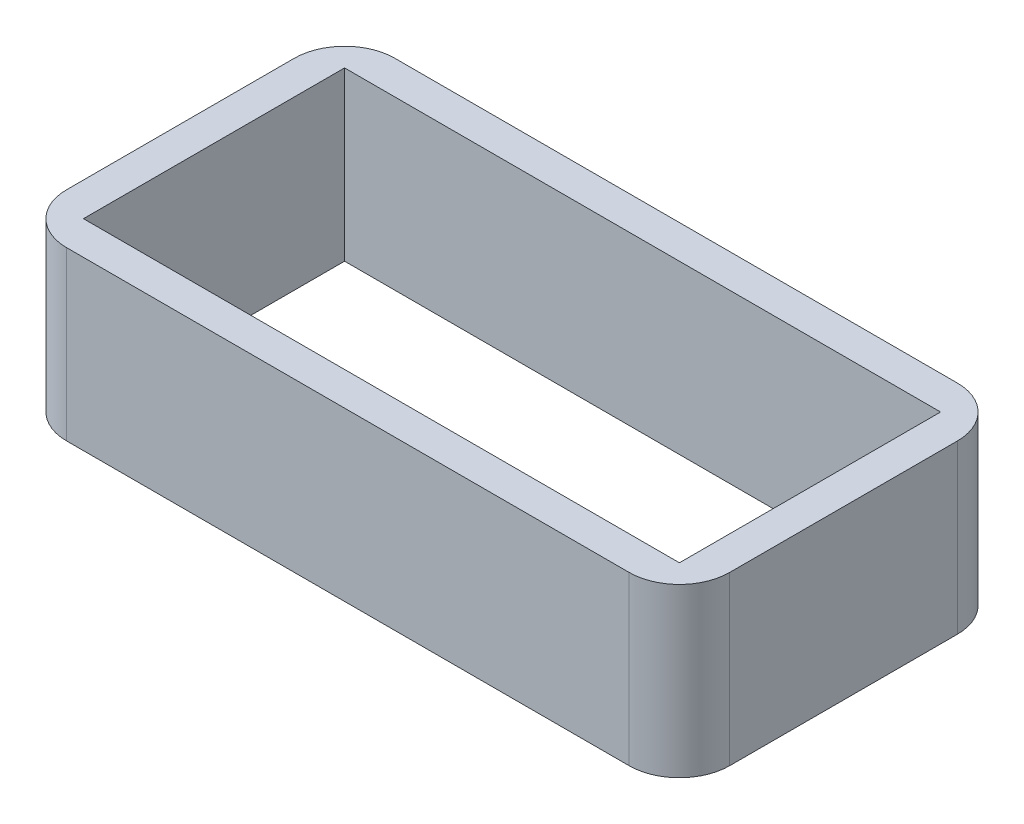
from build123d import *

# Parameters (mm, degrees)
SKETCH2_W           = 39.6
SKETCH2_H           = 19.6
SKETCH2_W_2         = 35.6
SKETCH2_H_2         = 15.6
BOSS_EXTRUDE2_DEPTH = 10
FILLET2_R           = 3


with BuildPart() as part:
    # Sketch2 → Boss-Extrude2 (new body)
    with BuildSketch(Plane(origin=(0, 0, 0), x_dir=(1, 0, 0), z_dir=(0, 1, 0))):
        Rectangle(SKETCH2_W, SKETCH2_H)
        Rectangle(SKETCH2_W_2, SKETCH2_H_2, mode=Mode.SUBTRACT)
    extrude(amount=BOSS_EXTRUDE2_DEPTH)

    # Fillet2
    fillet2_edges = [part.edges().sort_by_distance(p)[0] for p in [
        (19.8, 5, -9.8),
        (19.8, 5, 9.8),
        (-19.8, 5, 9.8),
        (-19.8, 5, -9.8),
    ]]
    fillet(fillet2_edges, radius=FILLET2_R)


solid = part.part
